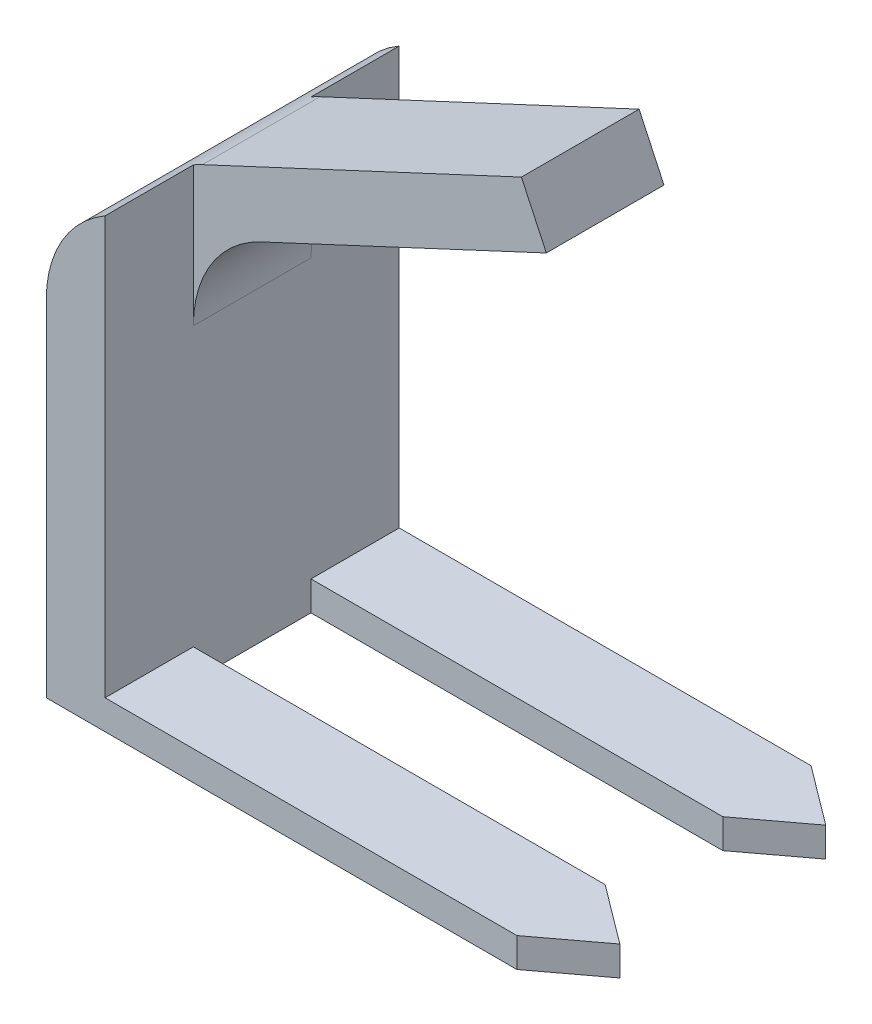
from build123d import *

# Parameters (mm, degrees)
SALIENTE_EXTRUIR1_DEPTH = 25
REDONDEO1_R             = 20
CORTAR_EXTRUIR1_DEPTH   = 10
CROQUIS3_W              = 70
CROQUIS3_H              = 15
CORTAR_EXTRUIR2_DEPTH   = 135.692464426


with BuildPart() as part:
    # Croquis1 → Saliente-Extruir1 (new, symmetric)
    with BuildSketch(Plane.XY):
        Polygon((0, 5), (0, 0), (-90, 0), (-90, 71.370702608), (-24.226182617, 102.04153736), (-20, 92.978459489), (-80, 65), (-80, 5), align=None)
    extrude(amount=SALIENTE_EXTRUIR1_DEPTH, both=True)

    # Redondeo1
    redondeo1_edges = [part.edges().sort_by_distance(p)[0] for p in [
        (-90, 71.370702608, 0),
        (-80, 65, 0),
    ]]
    fillet(redondeo1_edges, radius=REDONDEO1_R)

    # Croquis2 → Cortar-Extruir1 (cut)
    with BuildSketch(Plane(origin=(0, 5, 0), x_dir=(1, 0, 0), z_dir=(0, 1, 0))):
        Polygon((-80, 10), (-80, -10), (-10, -10), (0, -17.5), (0, 17.5), (-10, 10), align=None)
        Polygon((-10, 25), (0, 17.5), (0, 25), align=None)
        Polygon((0, -17.5), (-10, -25), (0, -25), align=None)
    extrude(amount=-CORTAR_EXTRUIR1_DEPTH, mode=Mode.SUBTRACT)

    # Croquis3 → Cortar-Extruir2 (cut, through all)
    with BuildSketch(Plane(origin=(0, 5, 0), x_dir=(1, 0, 0), z_dir=(0, 1, 0))):
        with Locations((-45, -17.5)):
            Rectangle(CROQUIS3_W, CROQUIS3_H)
        with Locations((-45, 17.5)):
            Rectangle(CROQUIS3_W, CROQUIS3_H)
    extrude(amount=CORTAR_EXTRUIR2_DEPTH, mode=Mode.SUBTRACT)


solid = part.part
